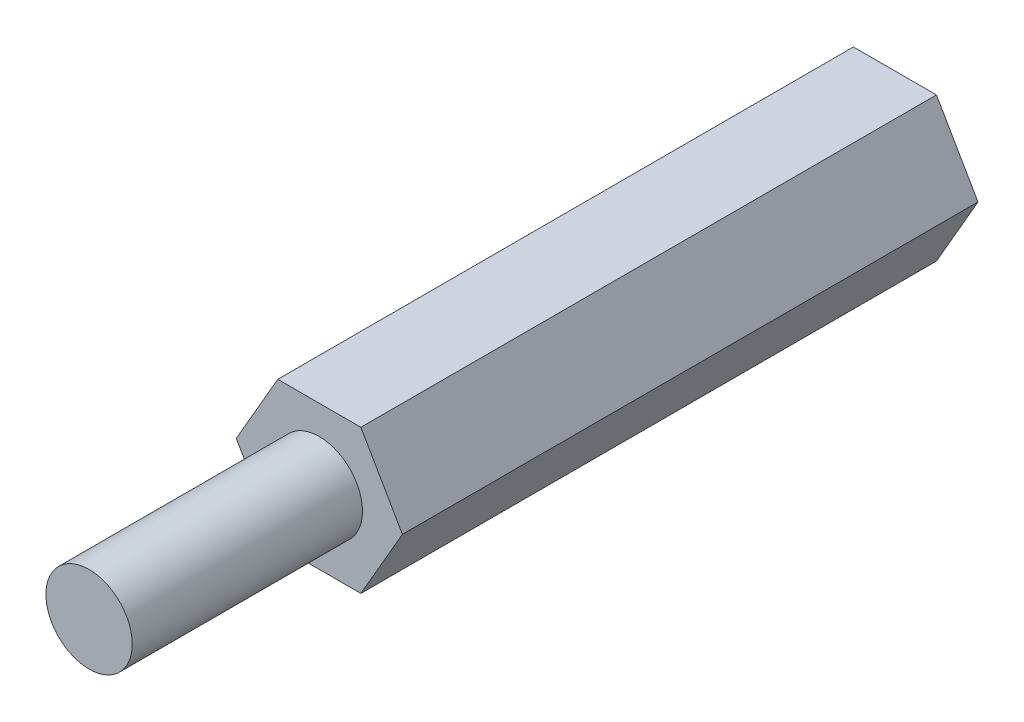
from build123d import *

# Parameters (mm, degrees)
EXTRUDE_1_DEPTH = 20
SKETCH_2_R      = 1.5
EXTRUDE_2_DEPTH = 8
M3X0_5_1_D      = 2.5
M3X0_5_1_DEPTH  = 11
M3X0_5_1_TIP    = 0.751075774


with BuildPart() as part:
    # 草图1 → 拉伸1 (new body)
    with BuildSketch(Plane.XY):
        Polygon((1.443375673, -2.5), (2.886751346, 0), (1.443375673, 2.5), (-1.443375673, 2.5), (-2.886751346, 0), (-1.443375673, -2.5), align=None)
    extrude(amount=EXTRUDE_1_DEPTH)

    # 草图2 → 拉伸2 (add)
    with BuildSketch(Plane.XY.offset(20)):
        Circle(SKETCH_2_R)
    extrude(amount=EXTRUDE_2_DEPTH)

    # M3x0.5 螺纹孔1
    with Locations(Plane(origin=(0, 0, 0), x_dir=(-1, 0, 0), z_dir=(0, 0, -1))):
        with Locations((0, 0)):
            Hole(M3X0_5_1_D / 2, depth=M3X0_5_1_DEPTH)
            with Locations((0, 0, -(M3X0_5_1_DEPTH + M3X0_5_1_TIP / 2))):  # 118° drill point
                Cone(0, M3X0_5_1_D / 2, M3X0_5_1_TIP, mode=Mode.SUBTRACT)


solid = part.part
